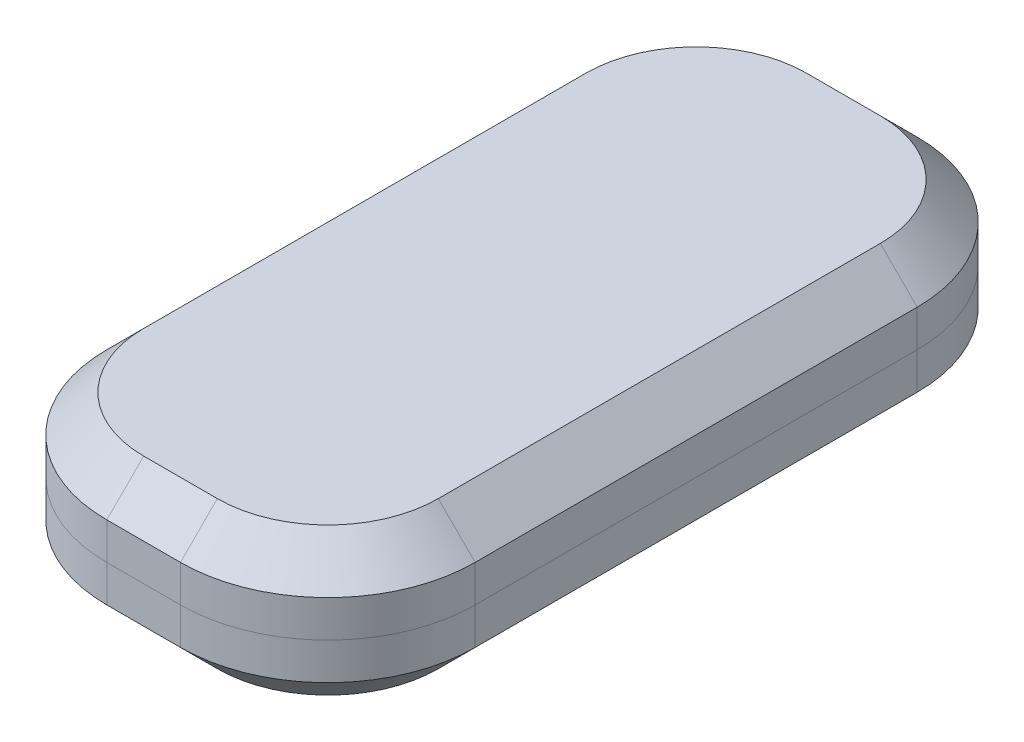
from build123d import *

# Parameters (mm, degrees)
BOSS_EXTRUDE1_DEPTH = 20
CHAMFER1_SIZE       = 5
SHELL1_T            = -2
SHELL2_T            = -2


with BuildPart() as part:
    # Sketch1 → Boss-Extrude1 (new body)
    with BuildSketch(Plane(origin=(0, 0, 0), x_dir=(1, 0, 0), z_dir=(0, 1, 0))):
        with BuildLine():
            Line((-5, -50), (5, -50))
            ThreePointArc((5, -50), (19.142135624, -44.142135624), (25, -30))
            Line((25, -30), (25, 30))
            ThreePointArc((25, 30), (19.142135624, 44.142135624), (5, 50))
            Line((5, 50), (-5, 50))
            ThreePointArc((-5, 50), (-19.142135624, 44.142135624), (-25, 30))
            Line((-25, 30), (-25, -30))
            ThreePointArc((-25, -30), (-19.142135624, -44.142135624), (-5, -50))
        make_face()
    extrude(amount=BOSS_EXTRUDE1_DEPTH)

    # Chamfer1
    chamfer1_edges = [part.edges().sort_by_distance(p)[0] for p in [
        (25, 0, 0),
        (19.142135624, 0, 44.142135624),
        (0, 0, 50),
        (-19.142135624, 0, 44.142135624),
        (19.142135624, 20, 44.142135624),
        (25, 20, 0),
        (19.142135624, 20, -44.142135624),
        (0, 20, -50),
        (-19.142135624, 20, -44.142135624),
        (-25, 20, 0),
        (-19.142135624, 20, 44.142135624),
        (-25, 0, 0),
        (0, 20, 50),
        (-19.142135624, 0, -44.142135624),
        (0, 0, -50),
        (19.142135624, 0, -44.142135624),
    ]]
    chamfer(chamfer1_edges, length=CHAMFER1_SIZE)


with BuildPart() as body_2:
    # Split1: the piece on the far side of the plane
    add(part.part)
    split(bisect_by=Plane.ZX.offset(10), keep=Keep.BOTTOM)

    # Shell1
    shell1_openings = [body_2.faces().sort_by_distance(p)[0] for p in [
        (0, 10, 0),
    ]]
    offset(amount=SHELL1_T, openings=shell1_openings, kind=Kind.INTERSECTION)


with BuildPart() as part_1:
    add(part.part)

    # Split1
    split(bisect_by=Plane.ZX.offset(10), keep=Keep.TOP)

    # Shell2
    shell2_openings = [part_1.faces().sort_by_distance(p)[0] for p in [
        (0, 10, 0),
    ]]
    offset(amount=SHELL2_T, openings=shell2_openings, kind=Kind.INTERSECTION)


solid = Compound([body_2.part, part_1.part])
